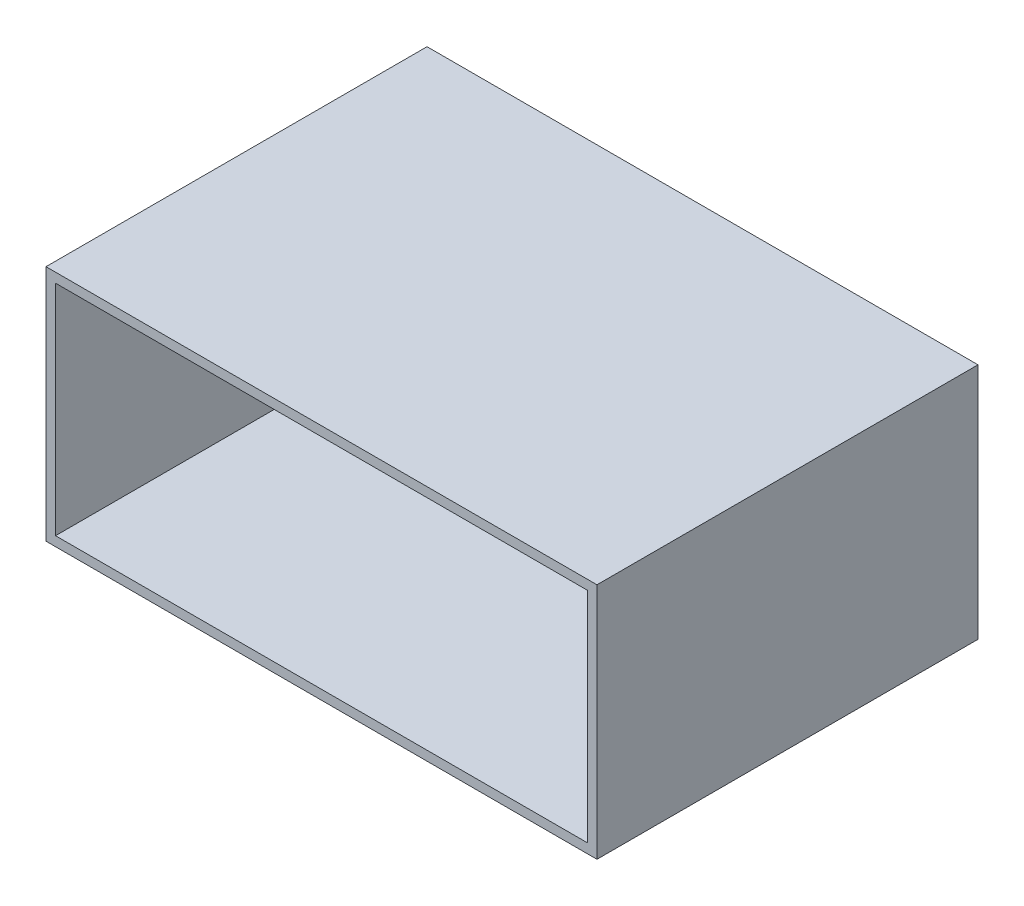
from build123d import *

# Parameters (mm, degrees)
SKETCH1_W           = 183.642
SKETCH1_H           = 79.248
SKETCH1_W_2         = 177.292
SKETCH1_H_2         = 72.898
EXTRUDE_THIN1_DEPTH = 127


with BuildPart() as part:
    # Sketch1 → Extrude-Thin1 (new body)
    with BuildSketch(Plane.XY):
        with Locations((88.646, 36.449)):
            Rectangle(SKETCH1_W, SKETCH1_H)
        with Locations((88.646, 36.449)):
            Rectangle(SKETCH1_W_2, SKETCH1_H_2, mode=Mode.SUBTRACT)
    extrude(amount=EXTRUDE_THIN1_DEPTH)


solid = part.part
